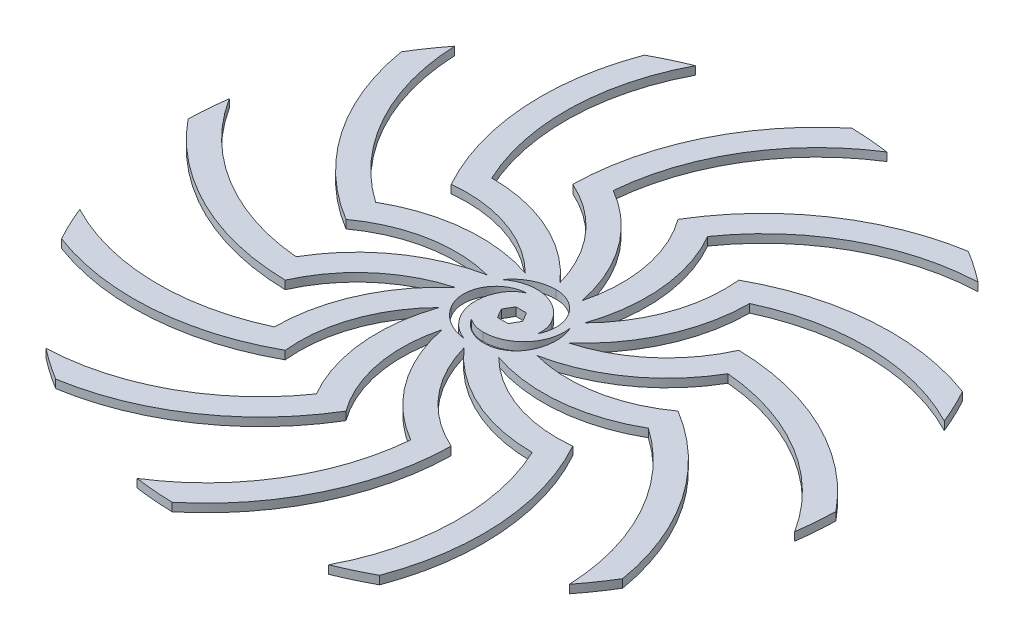
from build123d import *

# Parameters (mm, degrees)
BOSS_EXTRUDE1_DEPTH = 1
CIRPATTERN1_COUNT   = 12
SKETCH2_R           = 6.32456178
BOSS_EXTRUDE2_DEPTH = 1
CUT_EXTRUDE1_DEPTH  = 57.561097513
SCALE1_SCALE        = 3.4
CUT_EXTRUDE2_DEPTH  = 3.4


with BuildPart() as part:
    # Sketch1 → Boss-Extrude1 (new body)
    with BuildSketch(Plane(origin=(0, 0, 0), x_dir=(1, 0, 0), z_dir=(0, 1, 0))):
        with BuildLine():
            ThreePointArc((0, 20), (3.252272915, 10), (0, 0))
            Line((0, 0), (3.572780991, 0))
            ThreePointArc((3.572780991, 0), (6.252272915, 10), (3.572780991, 20))
            ThreePointArc((3.572780991, 20), (12.742280623, 28.230711371), (24.614013417, 31.530149754))
            ThreePointArc((24.614013417, 31.530149754), (22.757477342, 32.895246238), (20.825411836, 34.151167211))
            ThreePointArc((20.825411836, 34.151167211), (8.856268151, 29.366098374), (0, 20))
        make_face()
    extrude(amount=BOSS_EXTRUDE1_DEPTH)


with BuildPart() as cirpattern1_1:
    # CirPattern1: pattern copy
    add(part.part.rotate(Axis((0, 0, 0), (0, 1, 0)), 1 * 360 / CIRPATTERN1_COUNT))


with BuildPart() as cirpattern1_2:
    # CirPattern1: pattern copy
    add(part.part.rotate(Axis((0, 0, 0), (0, 1, 0)), 2 * 360 / CIRPATTERN1_COUNT))


with BuildPart() as cirpattern1_3:
    # CirPattern1: pattern copy
    add(part.part.rotate(Axis((0, 0, 0), (0, 1, 0)), 3 * 360 / CIRPATTERN1_COUNT))


with BuildPart() as cirpattern1_4:
    # CirPattern1: pattern copy
    add(part.part.rotate(Axis((0, 0, 0), (0, 1, 0)), 4 * 360 / CIRPATTERN1_COUNT))


with BuildPart() as cirpattern1_5:
    # CirPattern1: pattern copy
    add(part.part.rotate(Axis((0, 0, 0), (0, 1, 0)), 5 * 360 / CIRPATTERN1_COUNT))


with BuildPart() as cirpattern1_6:
    # CirPattern1: pattern copy
    add(part.part.rotate(Axis((0, 0, 0), (0, 1, 0)), 6 * 360 / CIRPATTERN1_COUNT))


with BuildPart() as cirpattern1_7:
    # CirPattern1: pattern copy
    add(part.part.rotate(Axis((0, 0, 0), (0, 1, 0)), 7 * 360 / CIRPATTERN1_COUNT))


with BuildPart() as cirpattern1_8:
    # CirPattern1: pattern copy
    add(part.part.rotate(Axis((0, 0, 0), (0, 1, 0)), 8 * 360 / CIRPATTERN1_COUNT))


with BuildPart() as cirpattern1_9:
    # CirPattern1: pattern copy
    add(part.part.rotate(Axis((0, 0, 0), (0, 1, 0)), 9 * 360 / CIRPATTERN1_COUNT))


with BuildPart() as cirpattern1_10:
    # CirPattern1: pattern copy
    add(part.part.rotate(Axis((0, 0, 0), (0, 1, 0)), 10 * 360 / CIRPATTERN1_COUNT))


with BuildPart() as cirpattern1_11:
    # CirPattern1: pattern copy
    add(part.part.rotate(Axis((0, 0, 0), (0, 1, 0)), 11 * 360 / CIRPATTERN1_COUNT))


with BuildPart() as part_1:
    add(part.part)

    add(cirpattern1_1.part)  # Boss-Extrude2 merges CirPattern1_1

    add(cirpattern1_2.part)  # Boss-Extrude2 merges CirPattern1_2

    add(cirpattern1_3.part)  # Boss-Extrude2 merges CirPattern1_3

    add(cirpattern1_4.part)  # Boss-Extrude2 merges CirPattern1_4

    add(cirpattern1_5.part)  # Boss-Extrude2 merges CirPattern1_5

    add(cirpattern1_6.part)  # Boss-Extrude2 merges CirPattern1_6

    add(cirpattern1_7.part)  # Boss-Extrude2 merges CirPattern1_7

    add(cirpattern1_8.part)  # Boss-Extrude2 merges CirPattern1_8

    add(cirpattern1_9.part)  # Boss-Extrude2 merges CirPattern1_9

    add(cirpattern1_10.part)  # Boss-Extrude2 merges CirPattern1_10

    add(cirpattern1_11.part)  # Boss-Extrude2 merges CirPattern1_11
    # Sketch2 → Boss-Extrude2 (add)
    with BuildSketch(Plane(origin=(0, 0, 0), x_dir=(1, 0, 0), z_dir=(0, 1, 0))):
        Circle(SKETCH2_R)
    extrude(amount=BOSS_EXTRUDE2_DEPTH)

    # Sketch3 → Cut-Extrude1 (cut, through all)
    with BuildSketch(Plane(origin=(0, 1, 0), x_dir=(1, 0, 0), z_dir=(0, 1, 0))):
        with BuildLine():
            ThreePointArc((-0.518779192, -5.29922884), (-3.404124769, -2.355249802), (-3.031088913, 1.75))
            ThreePointArc((-3.031088913, 1.75), (-2.338245241, 2.604344292), (-1.414452319, 3.201456643))
            ThreePointArc((-1.414452319, 3.201456643), (-4.658051165, 1.166519136), (-4.611205766, -2.66228089))
            ThreePointArc((-4.611205766, -2.66228089), (-2.884018037, -4.47586842), (-0.518779192, -5.29922884))
        make_face()
        with BuildLine():
            ThreePointArc((3.5, 0), (3.494938576, -0.188160443), (3.479768941, -0.375776681))
            ThreePointArc((3.479768941, -0.375776681), (3.339260789, 3.450731073), (0, 5.32456178))
            ThreePointArc((0, 5.32456178), (-2.434206737, 4.735567095), (-4.3298772, 3.098890379))
            ThreePointArc((-4.3298772, 3.098890379), (-0.337643776, 4.125683429), (3.031088913, 1.75))
            ThreePointArc((3.031088913, 1.75), (3.380740392, 0.905866658), (3.5, 0))
        make_face()
        with BuildLine():
            ThreePointArc((0, -3.5), (-1.086305696, -3.327151925), (-2.065316622, -2.825679962))
            ThreePointArc((-2.065316622, -2.825679962), (1.318790377, -4.617250209), (4.611205766, -2.66228089))
            ThreePointArc((4.611205766, -2.66228089), (5.143131737, -1.378097996), (5.32456178, 0))
            ThreePointArc((5.32456178, 0), (5.204225623, 1.1256082), (4.848656392, 2.200338461))
            ThreePointArc((4.848656392, 2.200338461), (3.741768545, -1.770433627), (0, -3.5))
        make_face()
    extrude(amount=-CUT_EXTRUDE1_DEPTH, mode=Mode.SUBTRACT)


with BuildPart() as part_2:
    # Scale1: scaled about (0, 0.5, 0)
    add(part_1.part.scale(SCALE1_SCALE).moved(Location((0, -1.2, 0))))

    # Sketch4 → Cut-Extrude2 (cut)
    with BuildSketch(Plane(origin=(0, 2.2, 0), x_dir=(1, 0, 0), z_dir=(0, 1, 0))):
        Polygon((-4.35, 0), (-2.175, -3.767210506), (2.175, -3.767210506), (4.35, 0), (2.175, 3.767210506), (-2.175, 3.767210506), align=None)
    extrude(amount=-CUT_EXTRUDE2_DEPTH, mode=Mode.SUBTRACT)


solid = part_2.part
